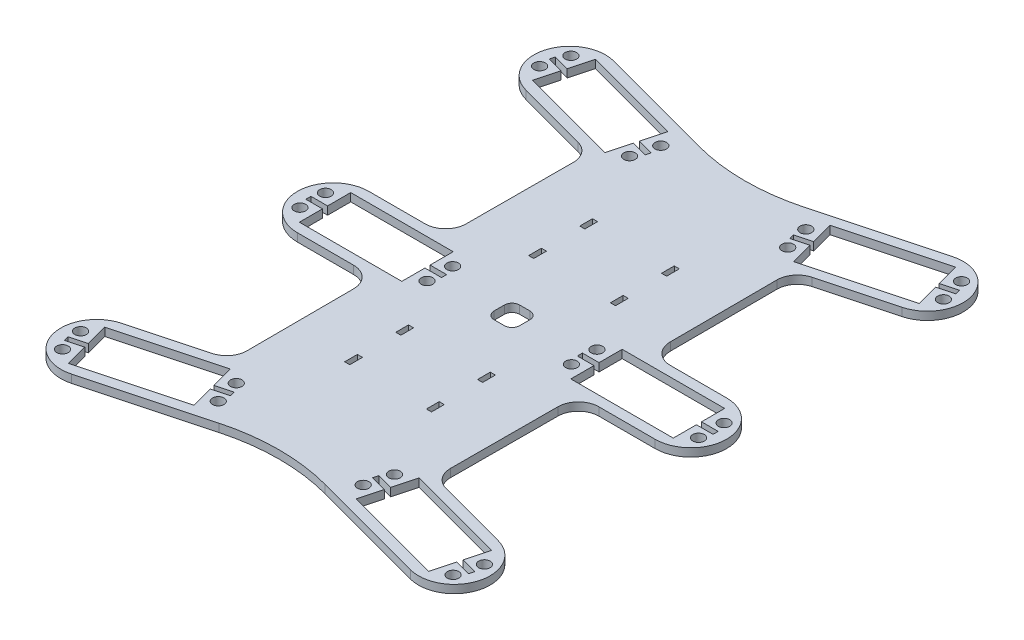
from build123d import *

# Parameters (mm, degrees)
SKETCH1_R           = 2.25
SKETCH1_W           = 40.1
SKETCH1_H           = 20.1
BOSS_EXTRUDE1_DEPTH = 3.175
FILLET1_R           = 80
FILLET2_R           = 8
SKETCH5_W           = 6.5
SKETCH5_H           = 2
CUT_EXTRUDE2_DEPTH  = 136.741386774
SKETCH6_W           = 2
SKETCH6_H           = 5
SKETCH6_W_2         = 10
SKETCH6_H_2         = 10
CUT_EXTRUDE3_DEPTH  = 10
FILLET3_R           = 3


with BuildPart() as part:
    # Sketch1 → Boss-Extrude1 (new body)
    with BuildSketch(Plane(origin=(0, 0, 0), x_dir=(1, 0, 0), z_dir=(0, 1, 0))):
        with BuildLine():
            Line((-70, 14), (-40, 14))
            Line((-40, 14), (-39.816062711, 70))
            Line((-39.816062711, 70), (-73.623466631, 79.058666579))
            ThreePointArc((-73.623466631, 79.058666579), (-83.522961568, 96.205094778), (-66.376533369, 106.104589715))
            Line((-66.376533369, 106.104589715), (0, 88.319051202))
            Line((0, 88.319051202), (66.376533369, 106.104589715))
            ThreePointArc((66.376533369, 106.104589715), (83.522961568, 96.205094778), (73.623466631, 79.058666579))
            Line((73.623466631, 79.058666579), (39.816062711, 70))
            Line((39.816062711, 70), (40, 14))
            Line((40, 14), (70, 14))
            ThreePointArc((70, 14), (84, 0), (70, -14))
            Line((70, -14), (40, -14))
            Line((40, -14), (39.816062711, -70))
            Line((39.816062711, -70), (73.623466631, -79.058666579))
            ThreePointArc((73.623466631, -79.058666579), (83.522961568, -96.205094778), (66.376533369, -106.104589715))
            Line((66.376533369, -106.104589715), (0, -88.319051202))
            Line((0, -88.319051202), (-66.376533369, -106.104589715))
            ThreePointArc((-66.376533369, -106.104589715), (-83.522961568, -96.205094778), (-73.623466631, -79.058666579))
            Line((-73.623466631, -79.058666579), (-39.816062711, -70))
            Line((-39.816062711, -70), (-40, -14))
            Line((-40, -14), (-70, -14))
            ThreePointArc((-70, -14), (-84, 0), (-70, 14))
        make_face()
        with Locations(Location((-76.433311385, 99.481809639, 0), (0, 0, 270))):
            Circle(SKETCH1_R, mode=Mode.SUBTRACT)
        with Locations(Location((-79.021501836, 89.822551376, 0), (0, 0, 270))):
            Circle(SKETCH1_R, mode=Mode.SUBTRACT)
        with Locations(Location((-78, 5, 0), (0, 0, 270))):
            Circle(SKETCH1_R, mode=Mode.SUBTRACT)
        with Locations(Location((-79.021501836, -89.822551376, 0), (0, 0, 90))):
            Circle(SKETCH1_R, mode=Mode.SUBTRACT)
        with Locations(Location((-76.433311385, -99.481809639, 0), (0, 0, 90))):
            Circle(SKETCH1_R, mode=Mode.SUBTRACT)
        with Locations(Location((-78, -5, 0), (0, 0, 270))):
            Circle(SKETCH1_R, mode=Mode.SUBTRACT)
        with Locations(Location((78, -5, 0), (0, 0, 90))):
            Circle(SKETCH1_R, mode=Mode.SUBTRACT)
        with Locations(Location((76.433311385, -99.481809639, 0), (0, 0, 270))):
            Circle(SKETCH1_R, mode=Mode.SUBTRACT)
        with Locations(Location((79.021501836, -89.822551376, 0), (0, 0, 270))):
            Circle(SKETCH1_R, mode=Mode.SUBTRACT)
        with Locations(Location((78, 5, 0), (0, 0, 90))):
            Circle(SKETCH1_R, mode=Mode.SUBTRACT)
        with Locations(Location((79.021501836, 89.822551376, 0), (0, 0, 90))):
            Circle(SKETCH1_R, mode=Mode.SUBTRACT)
        with Locations(Location((76.433311385, 99.481809639, 0), (0, 0, 90))):
            Circle(SKETCH1_R, mode=Mode.SUBTRACT)
        with Locations(Location((-30.95703272, 76.943715692, 0), (0, 0, 90))):
            Circle(SKETCH1_R, mode=Mode.SUBTRACT)
        with Locations(Location((-28.368842269, 86.602973955, 0), (0, 0, 90))):
            Circle(SKETCH1_R, mode=Mode.SUBTRACT)
        with Locations(Location((-28.24, -5, 0), (0, 0, 90))):
            Circle(SKETCH1_R, mode=Mode.SUBTRACT)
        with Locations(Location((-28.24, 5, 0), (0, 0, 90))):
            Circle(SKETCH1_R, mode=Mode.SUBTRACT)
        with Locations(Location((-28.368842269, -86.602973955, 0), (0, 0, 270))):
            Circle(SKETCH1_R, mode=Mode.SUBTRACT)
        with Locations(Location((-30.95703272, -76.943715692, 0), (0, 0, 270))):
            Circle(SKETCH1_R, mode=Mode.SUBTRACT)
        with Locations(Location((28.368842269, 86.602973955, 0), (0, 0, 270))):
            Circle(SKETCH1_R, mode=Mode.SUBTRACT)
        with Locations(Location((30.95703272, 76.943715692, 0), (0, 0, 270))):
            Circle(SKETCH1_R, mode=Mode.SUBTRACT)
        with Locations(Location((28.24, 5, 0), (0, 0, 270))):
            Circle(SKETCH1_R, mode=Mode.SUBTRACT)
        with Locations(Location((28.24, -5, 0), (0, 0, 270))):
            Circle(SKETCH1_R, mode=Mode.SUBTRACT)
        with Locations(Location((30.95703272, -76.943715692, 0), (0, 0, 90))):
            Circle(SKETCH1_R, mode=Mode.SUBTRACT)
        with Locations(Location((28.368842269, -86.602973955, 0), (0, 0, 90))):
            Circle(SKETCH1_R, mode=Mode.SUBTRACT)
        Polygon((-70.460853466, 103.109639074), (-75.663116273, 83.694529965), (-36.929490638, 73.315886257), (-31.727227832, 92.730995365), align=None, mode=Mode.SUBTRACT)
        with Locations((-53.12, 0)):
            Rectangle(SKETCH1_W, SKETCH1_H, mode=Mode.SUBTRACT)
        Polygon((-36.929490638, -73.315886257), (-31.727227832, -92.730995365), (-70.460853466, -103.109639074), (-75.663116273, -83.694529965), align=None, mode=Mode.SUBTRACT)
        Polygon((36.929490638, 73.315886257), (31.727227832, 92.730995365), (70.460853466, 103.109639074), (75.663116273, 83.694529965), align=None, mode=Mode.SUBTRACT)
        with Locations((53.12, 0)):
            Rectangle(SKETCH1_W, SKETCH1_H, mode=Mode.SUBTRACT)
        Polygon((36.929490638, -73.315886257), (31.727227832, -92.730995365), (70.460853466, -103.109639074), (75.663116273, -83.694529965), align=None, mode=Mode.SUBTRACT)
    extrude(amount=BOSS_EXTRUDE1_DEPTH)

    # Fillet1
    fillet1_edges = [part.edges().sort_by_distance(p)[0] for p in [
        (0, 1.5875, -88.319051202),
        (0, 1.5875, 88.319051202),
    ]]
    fillet(fillet1_edges, radius=FILLET1_R)

    # Fillet2
    fillet2_edges = [part.edges().sort_by_distance(p)[0] for p in [
        (-40, 1.5875, -14),
        (-39.816062711, 1.5875, -70),
        (39.816062711, 1.5875, -70),
        (40, 1.5875, -14),
        (40, 1.5875, 14),
        (39.816062711, 1.5875, 70),
        (-39.816062711, 1.5875, 70),
        (-40, 1.5875, 14),
    ]]
    fillet(fillet2_edges, radius=FILLET2_R)

    # Sketch5 → Cut-Extrude2 (cut, through all)
    with BuildSketch(Plane(origin=(0, 3.175, 0), x_dir=(1, 0, 0), z_dir=(0, 1, 0))):
        with Locations((-29.82, 0)):
            Rectangle(SKETCH5_W, SKETCH5_H)
        with Locations((-76.42, 0)):
            Rectangle(SKETCH5_W, SKETCH5_H)
        Polygon((-34.06954019, 83.989366637), (-27.791022319, 82.307042844), (-28.308660409, 80.375191192), (-34.58717828, 82.057514985), align=None)
        Polygon((-72.803165824, 94.368010346), (-73.320803914, 92.436158693), (-79.599321785, 94.118482486), (-79.081683695, 96.050334139), align=None)
        Polygon((72.803165824, 94.368010346), (79.081683695, 96.050334139), (79.599321785, 94.118482486), (73.320803914, 92.436158693), align=None)
        Polygon((34.06954019, 83.989366637), (34.58717828, 82.057514985), (28.308660409, 80.375191192), (27.791022319, 82.307042844), align=None)
        with Locations((76.42, 0)):
            Rectangle(SKETCH5_W, SKETCH5_H)
        with Locations((29.82, 0)):
            Rectangle(SKETCH5_W, SKETCH5_H)
        Polygon((34.06954019, -83.989366637), (27.791022319, -82.307042844), (28.308660409, -80.375191192), (34.58717828, -82.057514985), align=None)
        Polygon((72.803165824, -94.368010346), (73.320803914, -92.436158693), (79.599321785, -94.118482486), (79.081683695, -96.050334139), align=None)
        Polygon((-72.803165824, -94.368010346), (-79.081683695, -96.050334139), (-79.599321785, -94.118482486), (-73.320803914, -92.436158693), align=None)
        Polygon((-34.06954019, -83.989366637), (-34.58717828, -82.057514985), (-28.308660409, -80.375191192), (-27.791022319, -82.307042844), align=None)
    extrude(amount=-CUT_EXTRUDE2_DEPTH, mode=Mode.SUBTRACT)

    # Sketch6 → Cut-Extrude3 (cut)
    with BuildSketch(Plane(origin=(0, 3.175, 0), x_dir=(1, 0, 0), z_dir=(0, 1, 0))):
        with Locations((-16, -26)):
            Rectangle(SKETCH6_W, SKETCH6_H)
        with Locations((-16, -46)):
            Rectangle(SKETCH6_W, SKETCH6_H)
        with Locations((16, -46)):
            Rectangle(SKETCH6_W, SKETCH6_H)
        with Locations((16, -26)):
            Rectangle(SKETCH6_W, SKETCH6_H)
        with Locations((16, 26)):
            Rectangle(SKETCH6_W, SKETCH6_H)
        with Locations((16, 46)):
            Rectangle(SKETCH6_W, SKETCH6_H)
        with Locations((-16, 46)):
            Rectangle(SKETCH6_W, SKETCH6_H)
        with Locations((-16, 26)):
            Rectangle(SKETCH6_W, SKETCH6_H)
        Rectangle(SKETCH6_W_2, SKETCH6_H_2)
    extrude(amount=-CUT_EXTRUDE3_DEPTH, mode=Mode.SUBTRACT)

    # Fillet3
    fillet3_edges = [part.edges().sort_by_distance(p)[0] for p in [
        (5, 1.5875, -5),
        (5, 1.5875, 5),
        (-5, 1.5875, 5),
        (-5, 1.5875, -5),
    ]]
    fillet(fillet3_edges, radius=FILLET3_R)


solid = part.part
